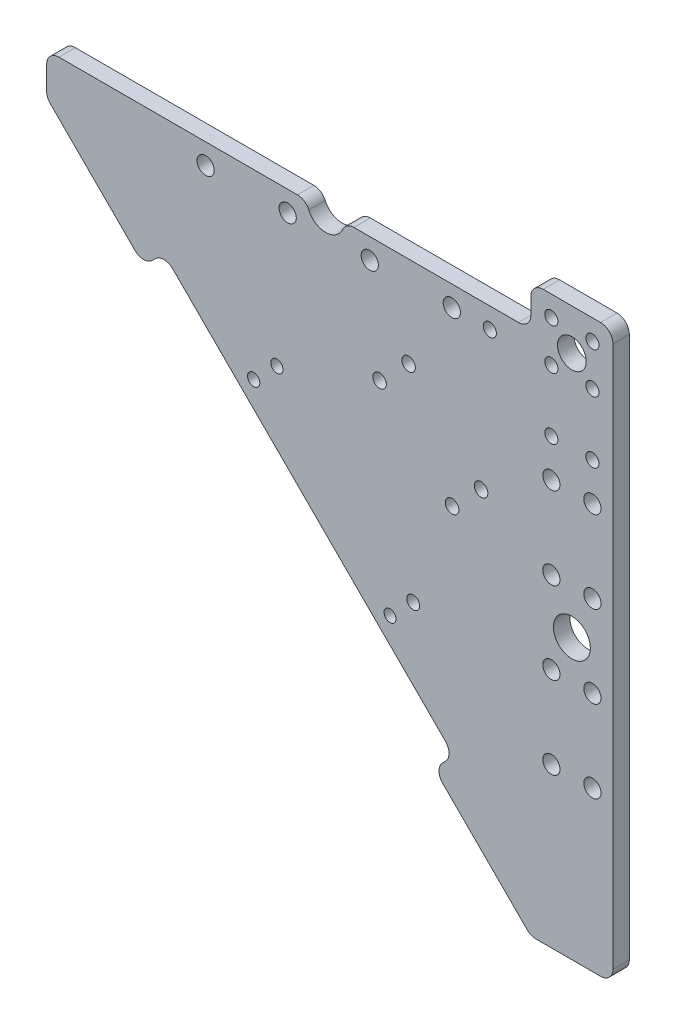
from build123d import *

# Parameters (mm, degrees)
SKETCH_1_R          = 1.462780711
SKETCH_1_R_2        = 1.582906388
SKETCH_1_R_3        = 1.5
SKETCH_1_R_4        = 1.65
EXTRUDE_1_DEPTH     = 4
SKETCH_3_R          = 3.5
SKETCH_3_R_2        = 1.6
CUT_EXTRUDE_1_DEPTH = 4
SKETCH_4_R          = 4.5
SKETCH_4_R_2        = 2.1
CUT_EXTRUDE_2_DEPTH = 4
CUT_EXTRUDE_7_DEPTH = 4
SKETCH_12_W         = 118
SKETCH_12_H         = 10
CUT_EXTRUDE_8_DEPTH = 4
SKETCH_13_W         = 20
SKETCH_13_H         = 15
SKETCH_13_R         = 1.6
EXTRUDE_4_DEPTH     = 4
FILLET_4_R          = 3
SKETCH_14_W         = 20
SKETCH_14_H         = 30
CUT_EXTRUDE_9_DEPTH = 182.063524764
FILLET_5_R          = 3


with BuildPart() as part:
    # 草图1 → 凸台-拉伸1 (new body)
    with BuildSketch(Plane.XY):
        Polygon((-128, 10), (-128, -10), (-10, -128), (10, -128), (10, 10), align=None)
        with Locations((-44.314491387, -77.548510103)):
            Circle(SKETCH_1_R, mode=Mode.SUBTRACT)
        with Locations((-38.657637138, -71.891655854)):
            Circle(SKETCH_1_R_2, mode=Mode.SUBTRACT)
        with Locations((-77.548510103, -44.314491387)):
            Circle(SKETCH_1_R_3, mode=Mode.SUBTRACT)
        with Locations((-71.891655854, -38.657637138)):
            Circle(SKETCH_1_R_3, mode=Mode.SUBTRACT)
        with Locations((-29.196699141, -46.874368671)):
            Circle(SKETCH_1_R_4, mode=Mode.SUBTRACT)
        with Locations((-46.874368671, -29.196699141)):
            Circle(SKETCH_1_R_4, mode=Mode.SUBTRACT)
        with Locations((-22.125631329, -39.803300859)):
            Circle(SKETCH_1_R_4, mode=Mode.SUBTRACT)
        with Locations((-39.803300859, -22.125631329)):
            Circle(SKETCH_1_R_4, mode=Mode.SUBTRACT)
    extrude(amount=EXTRUDE_1_DEPTH)

    # 草图3 → 切除-拉伸1 (cut)
    with BuildSketch(Plane.XY.offset(4)):
        Circle(SKETCH_3_R)
        with Locations((5, 5)):
            Circle(SKETCH_3_R_2)
        with Locations((-5, 5)):
            Circle(SKETCH_3_R_2)
        with Locations((-5, -5)):
            Circle(SKETCH_3_R_2)
        with Locations((5, -5)):
            Circle(SKETCH_3_R_2)
        with Locations((-20, -5)):
            Circle(SKETCH_3_R_2)
        with Locations((-5, -20)):
            Circle(SKETCH_3_R_2)
        with Locations((5, -20)):
            Circle(SKETCH_3_R_2)
        with Locations((5, 20)):
            Circle(SKETCH_3_R_2)
        with Locations((-5, 20)):
            Circle(SKETCH_3_R_2)
        with Locations((20, -5)):
            Circle(SKETCH_3_R_2)
        with Locations((20, 5)):
            Circle(SKETCH_3_R_2)
        with Locations((-20, 5)):
            Circle(SKETCH_3_R_2)
    extrude(amount=-CUT_EXTRUDE_1_DEPTH, mode=Mode.SUBTRACT)

    # 草图4 → 切除-拉伸2 (cut)
    with BuildSketch(Plane.XY.offset(4)):
        with Locations((0, -60)):
            Circle(SKETCH_4_R)
        with Locations((-5, -29.263884189)):
            Circle(SKETCH_4_R_2)
        with Locations((5, -29.263884189)):
            Circle(SKETCH_4_R_2)
        with Locations((5, -49.263884189)):
            Circle(SKETCH_4_R_2)
        with Locations((5, -69.263884189)):
            Circle(SKETCH_4_R_2)
        with Locations((5, -89.263884189)):
            Circle(SKETCH_4_R_2)
        with Locations((-5, -49.263884189)):
            Circle(SKETCH_4_R_2)
        with Locations((-5, -69.263884189)):
            Circle(SKETCH_4_R_2)
        with Locations((-5, -89.263884189)):
            Circle(SKETCH_4_R_2)
        with Locations(Location((-89.263884189, -5, 0), (0, 0, 180))):
            Circle(SKETCH_4_R_2)
        with Locations(Location((-69.263884189, -5, 0), (0, 0, 180))):
            Circle(SKETCH_4_R_2)
        with Locations(Location((-49.263884189, -5, 0), (0, 0, 180))):
            Circle(SKETCH_4_R_2)
        with Locations(Location((-89.263884189, 5, 0), (0, 0, 180))):
            Circle(SKETCH_4_R_2)
        with Locations(Location((-69.263884189, 5, 0), (0, 0, 180))):
            Circle(SKETCH_4_R_2)
        with Locations(Location((-49.263884189, 5, 0), (0, 0, 180))):
            Circle(SKETCH_4_R_2)
        with Locations(Location((-29.263884189, 5, 0), (0, 0, 180))):
            Circle(SKETCH_4_R_2)
        with Locations(Location((-29.263884189, -5, 0), (0, 0, 180))):
            Circle(SKETCH_4_R_2)
        with Locations(Location((-60, 0, 0), (0, 0, 180))):
            Circle(SKETCH_4_R)
    extrude(amount=-CUT_EXTRUDE_2_DEPTH, mode=Mode.SUBTRACT)

    # 草图11 → 切除-拉伸7 (cut)
    with BuildSketch(Plane.XY.offset(4)):
        Polygon((-69, -69), (-64.050252532, -64.050252532), (-99.405591591, -28.694913472), (-104.355339059, -33.644660941), align=None)
        Polygon((-28.694913472, -99.405591591), (-64.050252532, -64.050252532), (-69, -69), (-33.644660941, -104.355339059), align=None)
    extrude(amount=-CUT_EXTRUDE_7_DEPTH, mode=Mode.SUBTRACT)

    # 草图12 → 切除-拉伸8 (cut)
    with BuildSketch(Plane.XY.offset(4)):
        with Locations((-69, 5)):
            Rectangle(SKETCH_12_W, SKETCH_12_H)
    extrude(amount=-CUT_EXTRUDE_8_DEPTH, mode=Mode.SUBTRACT)

    # 草图13 → 凸台-拉伸4 (add)
    with BuildSketch(Plane.XY.offset(4)):
        with Locations((0, 17.5)):
            Rectangle(SKETCH_13_W, SKETCH_13_H)
        with Locations((-5, 20)):
            Circle(SKETCH_13_R, mode=Mode.SUBTRACT)
        with Locations((5, 20)):
            Circle(SKETCH_13_R, mode=Mode.SUBTRACT)
    extrude(amount=-EXTRUDE_4_DEPTH)

    # 圆角4
    fillet_4_edges = [part.edges().sort_by_distance(p)[0] for p in [
        (-99.405591591, -28.694913472, 2),
        (-28.694913472, -99.405591591, 2),
        (-33.644660941, -104.355339059, 2),
        (-104.355339059, -33.644660941, 2),
        (-64.5, 0, 2),
        (-55.5, 0, 2),
        (-10, 0, 2),
        (-128, 0, 2),
        (10, -128, 2),
        (-10, -128, 2),
        (-128, -10, 2),
        (10, 25, 2),
        (-10, 25, 2),
    ]]
    fillet(fillet_4_edges, radius=FILLET_4_R)

    # 草图14 → 切除-拉伸9 (cut, through all)
    with BuildSketch(Plane(origin=(0, 0, 0), x_dir=(-1, 0, 0), z_dir=(0, 0, -1))):
        with Locations((0, 25)):
            Rectangle(SKETCH_14_W, SKETCH_14_H)
    extrude(amount=-CUT_EXTRUDE_9_DEPTH, mode=Mode.SUBTRACT)

    # 圆角5
    fillet_5_edges = [part.edges().sort_by_distance(p)[0] for p in [
        (-10, 10, 2),
        (10, 10, 2),
    ]]
    fillet(fillet_5_edges, radius=FILLET_5_R)


solid = part.part
